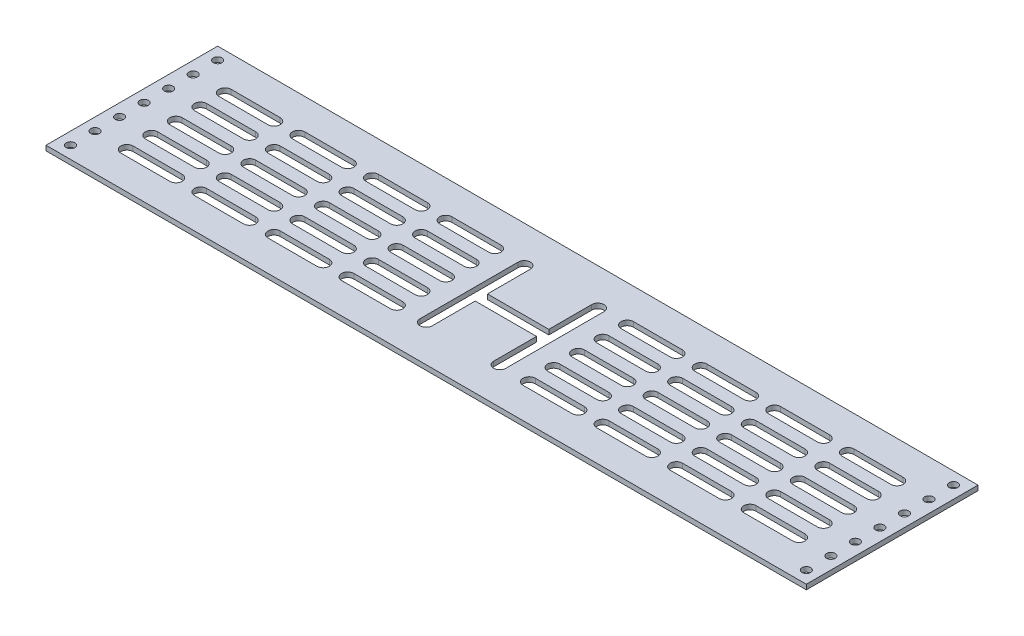
from build123d import *

# Parameters (mm, degrees)
EXTRUDE_1_DEPTH     = 2
SKETCH_2_R          = 1.75
CUT_EXTRUDE_1_DEPTH = 175.439101121
CUT_EXTRUDE_3_DEPTH = 10
CUT_EXTRUDE_4_DEPTH = 10


with BuildPart() as part:
    # 草图1 → 凸台-拉伸1 (new body)
    with BuildSketch(Plane(origin=(0, 0, 0), x_dir=(1, 0, 0), z_dir=(0, 1, 0))):
        Polygon((0, 0), (-155, 0), (-155, -80), (155, -80), (155, 0), align=None)
    extrude(amount=EXTRUDE_1_DEPTH)

    # 草图2 → 切除-拉伸1 (cut, through all)
    with BuildSketch(Plane(origin=(0, 2, 0), x_dir=(1, 0, 0), z_dir=(0, 1, 0))):
        with BuildLine():
            ThreePointArc((-150, -73.25), (-151.75, -75), (-150, -76.75))
            Line((-150, -76.75), (-150, -75))
            Line((-150, -75), (-150, -73.25))
        make_face()
        with BuildLine():
            Line((-150, -75), (-150, -76.75))
            ThreePointArc((-150, -76.75), (-148.762563133, -76.237436867), (-148.25, -75))
            ThreePointArc((-148.25, -75), (-148.762563133, -73.762563133), (-150, -73.25))
            Line((-150, -73.25), (-150, -75))
        make_face()
        with BuildLine():
            ThreePointArc((-150, -63.25), (-151.75, -65), (-150, -66.75))
            Line((-150, -66.75), (-150, -63.25))
        make_face()
        with BuildLine():
            Line((-150, -63.25), (-150, -66.75))
            ThreePointArc((-150, -66.75), (-148.762563133, -66.237436867), (-148.25, -65))
            ThreePointArc((-148.25, -65), (-148.762563133, -63.762563133), (-150, -63.25))
        make_face()
        with BuildLine():
            ThreePointArc((-150, -53.25), (-151.75, -55), (-150, -56.75))
            Line((-150, -56.75), (-150, -53.25))
        make_face()
        with BuildLine():
            Line((-150, -53.25), (-150, -56.75))
            ThreePointArc((-150, -56.75), (-148.762563133, -56.237436867), (-148.25, -55))
            ThreePointArc((-148.25, -55), (-148.762563133, -53.762563133), (-150, -53.25))
        make_face()
        with BuildLine():
            ThreePointArc((-150, -43.25), (-151.75, -45), (-150, -46.75))
            Line((-150, -46.75), (-150, -43.25))
        make_face()
        with BuildLine():
            Line((-150, -43.25), (-150, -46.75))
            ThreePointArc((-150, -46.75), (-148.762563133, -46.237436867), (-148.25, -45))
            ThreePointArc((-148.25, -45), (-148.762563133, -43.762563133), (-150, -43.25))
        make_face()
        with BuildLine():
            ThreePointArc((-150, -33.25), (-151.75, -35), (-150, -36.75))
            Line((-150, -36.75), (-150, -33.25))
        make_face()
        with BuildLine():
            Line((-150, -33.25), (-150, -36.75))
            ThreePointArc((-150, -36.75), (-148.762563133, -36.237436867), (-148.25, -35))
            ThreePointArc((-148.25, -35), (-148.762563133, -33.762563133), (-150, -33.25))
        make_face()
        with BuildLine():
            ThreePointArc((-150, -23.25), (-151.75, -25), (-150, -26.75))
            Line((-150, -26.75), (-150, -23.25))
        make_face()
        with BuildLine():
            Line((-150, -23.25), (-150, -26.75))
            ThreePointArc((-150, -26.75), (-148.762563133, -26.237436867), (-148.25, -25))
            ThreePointArc((-148.25, -25), (-148.762563133, -23.762563133), (-150, -23.25))
        make_face()
        with BuildLine():
            ThreePointArc((-150, -13.25), (-151.75, -15), (-150, -16.75))
            Line((-150, -16.75), (-150, -13.25))
        make_face()
        with BuildLine():
            Line((-150, -13.25), (-150, -16.75))
            ThreePointArc((-150, -16.75), (-148.762563133, -16.237436867), (-148.25, -15))
            ThreePointArc((-148.25, -15), (-148.762563133, -13.762563133), (-150, -13.25))
        make_face()
        with BuildLine():
            ThreePointArc((-150, -3.25), (-151.75, -5), (-150, -6.75))
            Line((-150, -6.75), (-150, -3.25))
        make_face()
        with BuildLine():
            Line((-150, -3.25), (-150, -6.75))
            ThreePointArc((-150, -6.75), (-148.762563133, -6.237436867), (-148.25, -5))
            ThreePointArc((-148.25, -5), (-148.762563133, -3.762563133), (-150, -3.25))
        make_face()
        with Locations(Location((150, -5, 0), (0, 0, 270))):
            Circle(SKETCH_2_R)
        with Locations(Location((150, -15, 0), (0, 0, 270))):
            Circle(SKETCH_2_R)
        with Locations(Location((150, -25, 0), (0, 0, 270))):
            Circle(SKETCH_2_R)
        with Locations(Location((150, -35, 0), (0, 0, 270))):
            Circle(SKETCH_2_R)
        with Locations(Location((150, -45, 0), (0, 0, 270))):
            Circle(SKETCH_2_R)
        with Locations(Location((150, -55, 0), (0, 0, 270))):
            Circle(SKETCH_2_R)
        with Locations(Location((150, -65, 0), (0, 0, 270))):
            Circle(SKETCH_2_R)
        with Locations(Location((150, -75, 0), (0, 0, 270))):
            Circle(SKETCH_2_R)
    extrude(amount=-CUT_EXTRUDE_1_DEPTH, mode=Mode.SUBTRACT)

    # 草图4 → 切除-拉伸3 (cut)
    with BuildSketch(Plane.XZ):
        Polygon((168.616628746, 10), (150, 10), (-155, 10), (-155, 0), (155, 0), align=None)
    extrude(amount=-CUT_EXTRUDE_3_DEPTH, mode=Mode.SUBTRACT)

    # 草图3 → 切除-拉伸4 (cut)
    with BuildSketch(Plane(origin=(0, 2, 0), x_dir=(1, 0, 0), z_dir=(0, 1, 0))):
        with BuildLine():
            Line((-12.5, -47.5), (0, -47.5))
            Line((0, -47.5), (12.5, -47.5))
            Line((12.5, -47.5), (12.5, -65))
            ThreePointArc((12.5, -65), (15, -67.5), (17.5, -65))
            Line((17.5, -65), (17.5, -25))
            ThreePointArc((17.5, -25), (15, -22.5), (12.5, -25))
            Line((12.5, -25), (12.5, -42.5))
            Line((12.5, -42.5), (-12.5, -42.5))
            Line((-12.5, -42.5), (-12.5, -25))
            ThreePointArc((-12.5, -25), (-15, -22.500000146), (-17.5, -25))
            Line((-17.5, -25), (-17.5, -65))
            ThreePointArc((-17.5, -65), (-15, -67.5), (-12.5, -65))
            Line((-12.5, -65), (-12.5, -47.5))
        make_face()
        with BuildLine():
            ThreePointArc((-117, -67.5), (-114.5, -65), (-117, -62.5))
            Line((-117, -62.5), (-137, -62.5))
            ThreePointArc((-137, -62.5), (-139.5, -65), (-137, -67.5))
            Line((-137, -67.5), (-117, -67.5))
        make_face()
        with BuildLine():
            ThreePointArc((-87, -67.5), (-84.5, -65), (-87, -62.5))
            Line((-87, -62.5), (-107, -62.5))
            ThreePointArc((-107, -62.5), (-109.5, -65), (-107, -67.5))
            Line((-107, -67.5), (-87, -67.5))
        make_face()
        with BuildLine():
            ThreePointArc((-117, -27.5), (-114.5, -25), (-117, -22.5))
            Line((-117, -22.5), (-137, -22.5))
            ThreePointArc((-137, -22.5), (-139.5, -25), (-137, -27.5))
            Line((-137, -27.5), (-117, -27.5))
        make_face()
        with BuildLine():
            ThreePointArc((-87, -27.5), (-84.5, -25), (-87, -22.5))
            Line((-87, -22.5), (-107, -22.5))
            ThreePointArc((-107, -22.5), (-109.5, -25), (-107, -27.5))
            Line((-107, -27.5), (-87, -27.5))
        make_face()
        with BuildLine():
            ThreePointArc((-47, -22.5), (-48.767766953, -23.232233047), (-49.5, -25))
            ThreePointArc((-49.5, -25), (-48.767766953, -26.767766953), (-47, -27.5))
            Line((-47, -27.5), (-27, -27.5))
            ThreePointArc((-27, -27.5), (-24.5, -25), (-27, -22.5))
            Line((-27, -22.5), (-47, -22.5))
        make_face()
        with BuildLine():
            Line((-77, -27.5), (-57, -27.5))
            ThreePointArc((-57, -27.5), (-54.5, -25), (-57, -22.5))
            Line((-57, -22.5), (-77, -22.5))
            ThreePointArc((-77, -22.5), (-79.5, -25), (-77, -27.5))
        make_face()
        with BuildLine():
            Line((-77, -37.5), (-57, -37.5))
            ThreePointArc((-57, -37.5), (-54.5, -35), (-57, -32.5))
            Line((-57, -32.5), (-77, -32.5))
            ThreePointArc((-77, -32.5), (-79.5, -35), (-77, -37.5))
        make_face()
        with BuildLine():
            Line((-77, -47.5), (-57, -47.5))
            ThreePointArc((-57, -47.5), (-54.5, -45), (-57, -42.5))
            Line((-57, -42.5), (-77, -42.5))
            ThreePointArc((-77, -42.5), (-79.5, -45), (-77, -47.5))
        make_face()
        with BuildLine():
            Line((-77, -57.5), (-57, -57.5))
            ThreePointArc((-57, -57.5), (-54.5, -55), (-57, -52.5))
            Line((-57, -52.5), (-77, -52.5))
            ThreePointArc((-77, -52.5), (-79.5, -55), (-77, -57.5))
        make_face()
        with BuildLine():
            ThreePointArc((-47, -62.5), (-48.767766953, -63.232233047), (-49.5, -65))
            ThreePointArc((-49.5, -65), (-48.767766953, -66.767766953), (-47, -67.5))
            Line((-47, -67.5), (-27, -67.5))
            ThreePointArc((-27, -67.5), (-24.5, -65), (-27, -62.5))
            Line((-27, -62.5), (-47, -62.5))
        make_face()
        with BuildLine():
            Line((-77, -67.5), (-57, -67.5))
            ThreePointArc((-57, -67.5), (-54.5, -65), (-57, -62.5))
            Line((-57, -62.5), (-77, -62.5))
            ThreePointArc((-77, -62.5), (-79.5, -65), (-77, -67.5))
        make_face()
        with BuildLine():
            ThreePointArc((-137, -52.5), (-139.5, -55), (-137, -57.5))
            Line((-137, -57.5), (-117, -57.5))
            ThreePointArc((-117, -57.5), (-114.5, -55), (-117, -52.5))
            Line((-117, -52.5), (-137, -52.5))
        make_face()
        with BuildLine():
            ThreePointArc((-107, -52.5), (-109.5, -55), (-107, -57.5))
            Line((-107, -57.5), (-87, -57.5))
            ThreePointArc((-87, -57.5), (-84.5, -55), (-87, -52.5))
            Line((-87, -52.5), (-107, -52.5))
        make_face()
        with BuildLine():
            ThreePointArc((-137, -42.5), (-139.5, -45), (-137, -47.5))
            Line((-137, -47.5), (-117, -47.5))
            ThreePointArc((-117, -47.5), (-114.5, -45), (-117, -42.5))
            Line((-117, -42.5), (-137, -42.5))
        make_face()
        with BuildLine():
            ThreePointArc((-107, -42.5), (-109.5, -45), (-107, -47.5))
            Line((-107, -47.5), (-87, -47.5))
            ThreePointArc((-87, -47.5), (-84.5, -45), (-87, -42.5))
            Line((-87, -42.5), (-107, -42.5))
        make_face()
        with BuildLine():
            ThreePointArc((-137, -32.5), (-139.5, -35), (-137, -37.5))
            Line((-137, -37.5), (-117, -37.5))
            ThreePointArc((-117, -37.5), (-114.5, -35), (-117, -32.5))
            Line((-117, -32.5), (-137, -32.5))
        make_face()
        with BuildLine():
            ThreePointArc((-107, -32.5), (-109.5, -35), (-107, -37.5))
            Line((-107, -37.5), (-87, -37.5))
            ThreePointArc((-87, -37.5), (-84.5, -35), (-87, -32.5))
            Line((-87, -32.5), (-107, -32.5))
        make_face()
        with BuildLine():
            ThreePointArc((-47, -52.5), (-49.5, -55), (-47, -57.5))
            Line((-47, -57.5), (-27, -57.5))
            ThreePointArc((-27, -57.5), (-24.5, -55), (-27, -52.5))
            Line((-27, -52.5), (-47, -52.5))
        make_face()
        with BuildLine():
            ThreePointArc((-47, -42.5), (-49.5, -45), (-47, -47.5))
            Line((-47, -47.5), (-27, -47.5))
            ThreePointArc((-27, -47.5), (-24.5, -45), (-27, -42.5))
            Line((-27, -42.5), (-47, -42.5))
        make_face()
        with BuildLine():
            ThreePointArc((-47, -32.5), (-49.5, -35), (-47, -37.5))
            Line((-47, -37.5), (-27, -37.5))
            ThreePointArc((-27, -37.5), (-24.5, -35), (-27, -32.5))
            Line((-27, -32.5), (-47, -32.5))
        make_face()
    cut_extrude_4 = extrude(amount=-CUT_EXTRUDE_4_DEPTH, mode=Mode.SUBTRACT)

    # 镜向1: 切除-拉伸4 across plane
    add(cut_extrude_4.mirror(Plane(origin=(0, 0, 0), x_dir=(0, 0, 1), z_dir=(1, 0, 0))), mode=Mode.SUBTRACT)


solid = part.part
